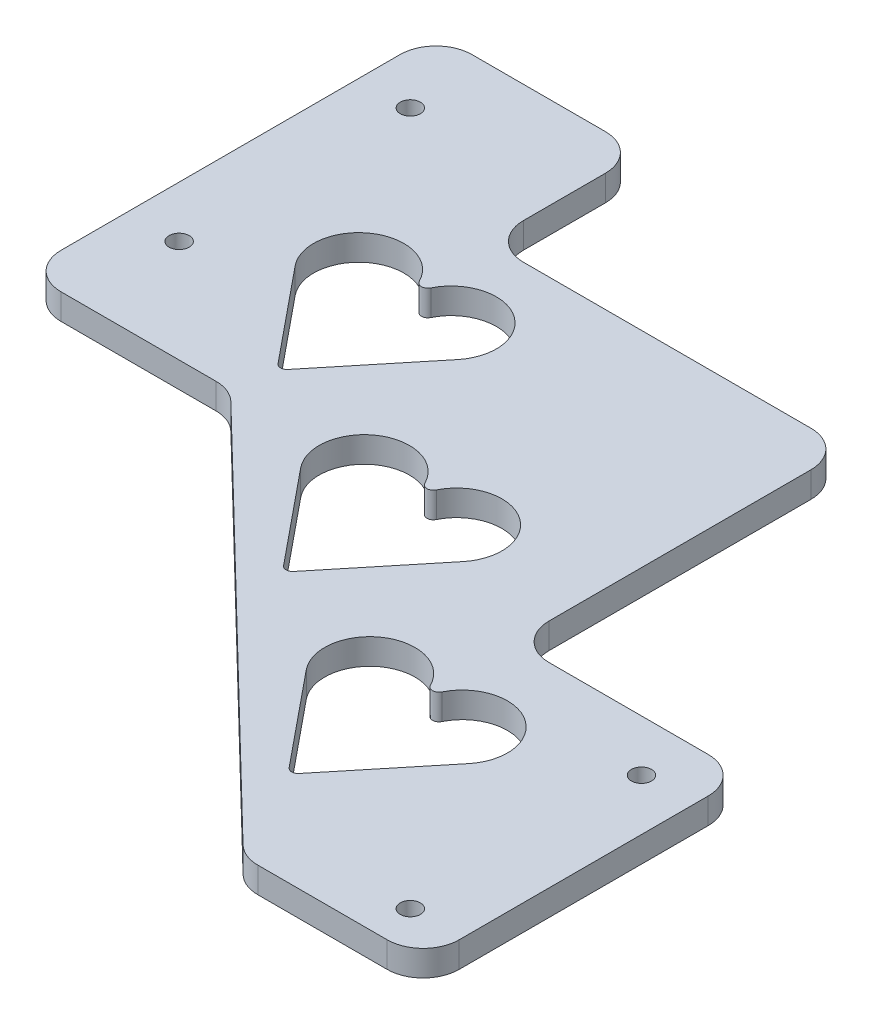
from build123d import *

# Parameters (mm, degrees)
SKETCH1_R           = 2.4892
BOSS_EXTRUDE1_DEPTH = 3.175
FILLET2_R           = 8.89
CUT_EXTRUDE2_DEPTH  = 246.195529119
FILLET3_R           = 1.5875


with BuildPart() as part:
    # Sketch1 → Boss-Extrude1 (new, symmetric)
    with BuildSketch(Plane(origin=(0, 0, 0), x_dir=(1, 0, 0), z_dir=(0, 1, 0))):
        Polygon((139.7, 25.4), (139.7, 107.95), (50.8, 107.95), (50.8, 146.05), (0, 146.05), (0, 107.95), (0, 44.45), (50.8, 44.45), (152.4, -53.975), (196.85, -53.975), (196.85, 0), (196.85, 25.4), align=None)
        with Locations(Location((184.15, -44.45, 0), (0, 0, 270))):
            Circle(SKETCH1_R, mode=Mode.SUBTRACT)
        with Locations(Location((184.15, 12.7, 0), (0, 0, 270))):
            Circle(SKETCH1_R, mode=Mode.SUBTRACT)
        with Locations(Location((12.7, 69.85, 0), (0, 0, 270))):
            Circle(SKETCH1_R, mode=Mode.SUBTRACT)
        with Locations(Location((12.7, 127, 0), (0, 0, 270))):
            Circle(SKETCH1_R, mode=Mode.SUBTRACT)
    extrude(amount=BOSS_EXTRUDE1_DEPTH, both=True)

    # Fillet2
    fillet2_edges = [part.edges().sort_by_distance(p)[0] for p in [
        (50.8, 0, -107.95),
        (139.7, 0, -107.95),
        (139.7, 0, -25.4),
        (196.85, 0, -25.4),
        (196.85, 0, 53.975),
        (152.4, 0, 53.975),
        (50.8, 0, -44.45),
        (0, 0, -44.45),
        (0, 0, -146.05),
        (50.8, 0, -146.05),
    ]]
    fillet(fillet2_edges, radius=FILLET2_R)

    # Sketch4 → Cut-Extrude2 (cut, through all)
    with BuildSketch(Plane(origin=(0, 3.175, 0), x_dir=(1, 0, 0), z_dir=(0, 1, 0))):
        with BuildLine():
            Line((32.261000835, 78.9647419), (52.342813318, 54.372399446))
            Line((52.342813318, 54.372399446), (72.424625802, 78.9647419))
            ThreePointArc((72.424625802, 78.9647419), (69.796699914, 95.436110561), (53.736462526, 90.93269463))
            Line((53.736462526, 90.93269463), (52.342813318, 88.079912324))
            Line((52.342813318, 88.079912324), (50.949164111, 90.93269463))
            ThreePointArc((50.949164111, 90.93269463), (34.888926723, 95.436110561), (32.261000835, 78.9647419))
        make_face()
        with BuildLine():
            Line((76.202071803, 36.3968294), (96.283884286, 11.804486946))
            Line((96.283884286, 11.804486946), (116.365696769, 36.3968294))
            ThreePointArc((116.365696769, 36.3968294), (113.737770882, 52.868198061), (97.677533493, 48.36478213))
            Line((97.677533493, 48.36478213), (96.283884286, 45.511999824))
            Line((96.283884286, 45.511999824), (94.890235079, 48.36478213))
            ThreePointArc((94.890235079, 48.36478213), (78.82999769, 52.868198061), (76.202071803, 36.3968294))
        make_face()
        with BuildLine():
            Line((120.14314277, -6.171083099), (140.224955253, -30.763425554))
            Line((140.224955253, -30.763425554), (160.306767736, -6.171083099))
            ThreePointArc((160.306767736, -6.171083099), (157.678841849, 10.300285561), (141.618604461, 5.796869631))
            Line((141.618604461, 5.796869631), (140.224955253, 2.944087324))
            Line((140.224955253, 2.944087324), (138.831306046, 5.796869631))
            ThreePointArc((138.831306046, 5.796869631), (122.771068658, 10.300285561), (120.14314277, -6.171083099))
        make_face()
    extrude(amount=-CUT_EXTRUDE2_DEPTH, mode=Mode.SUBTRACT)

    # Fillet3
    fillet3_edges = [part.edges().sort_by_distance(p)[0] for p in [
        (52.342813318, 0, -88.079912324),
        (52.342813318, 0, -54.372399446),
        (140.224955253, 0, -2.944087324),
        (140.224955253, 0, 30.763425554),
        (96.283884286, 0, -11.804486946),
        (96.283884286, 0, -45.511999824),
    ]]
    fillet(fillet3_edges, radius=FILLET3_R)


solid = part.part
